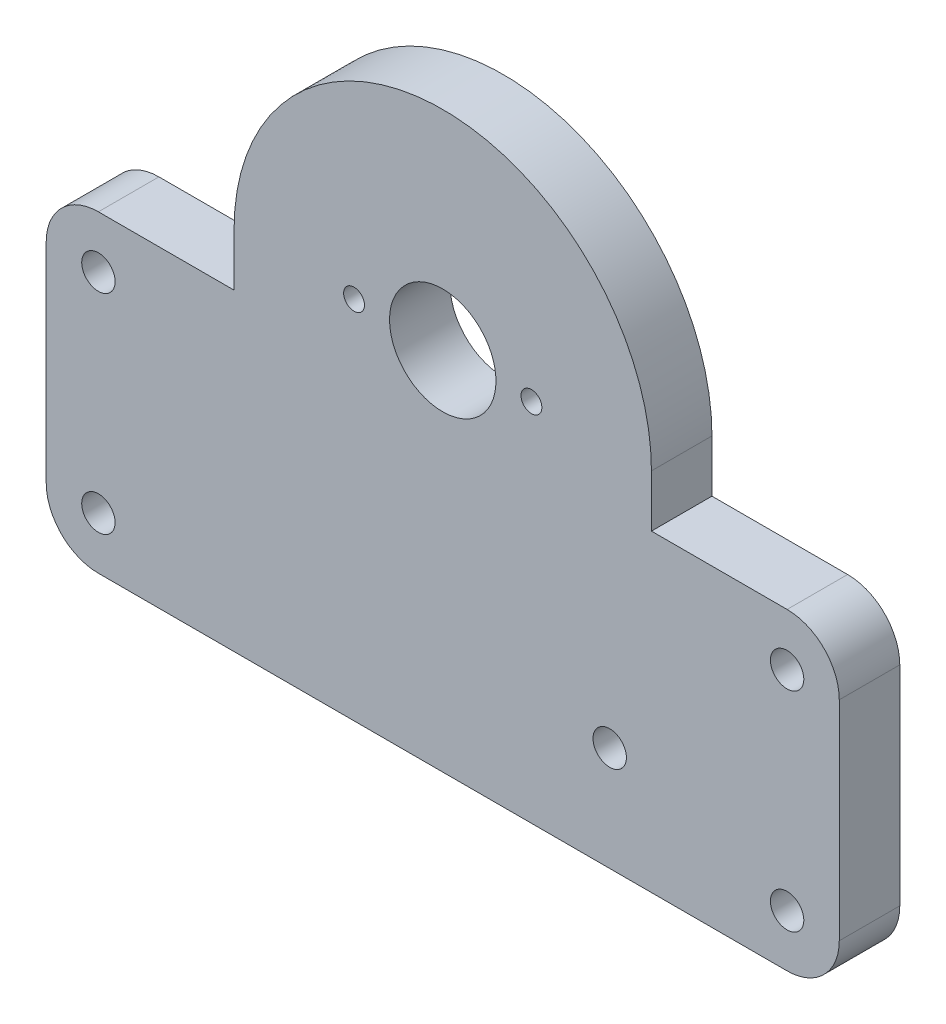
from build123d import *

# Parameters (mm, degrees)
SKETCH_1_W          = 76
SKETCH_1_H          = 60
EXTRUDE_3_DEPTH     = 5.8
SKETCH_4_R          = 5.1
SKETCH_4_R_2        = 1.6
CUT_EXTRUDE_2_DEPTH = 50
FILLET_4_R          = 5
CUT_EXTRUDE_7_DEPTH = 13.5
FILLET_8_R          = 5
SKETCH_11_R         = 1
CUT_EXTRUDE_8_DEPTH = 49.76105003
SKETCH_12_R         = 1.6
CUT_EXTRUDE_9_DEPTH = 49.76105003


with BuildPart() as part:
    # ｽｹｯﾁ1 → ﾎﾞｽ - 押し出し3 (new body)
    with BuildSketch(Plane.XY):
        Rectangle(SKETCH_1_W, SKETCH_1_H)
    extrude(amount=EXTRUDE_3_DEPTH)

    # ｽｹｯﾁ4 → ｶｯﾄ - 押し出し2 (cut)
    with BuildSketch(Plane(origin=(0, 0, 0), x_dir=(-1, 0, 0), z_dir=(0, 0, -1))):
        with Locations((0, 5)):
            Circle(SKETCH_4_R)
        with Locations((-33, -5)):
            Circle(SKETCH_4_R_2)
        with Locations((-33, -25)):
            Circle(SKETCH_4_R_2)
        with Locations((33, -25)):
            Circle(SKETCH_4_R_2)
        with Locations((33, -5)):
            Circle(SKETCH_4_R_2)
    extrude(amount=-CUT_EXTRUDE_2_DEPTH, mode=Mode.SUBTRACT)

    # ﾌｨﾚｯﾄ4
    fillet_4_edges = [part.edges().sort_by_distance(p)[0] for p in [
        (38, -30, 2.9),
        (-38, -30, 2.9),
        (-38, 30, 2.9),
        (38, 30, 2.9),
    ]]
    fillet(fillet_4_edges, radius=FILLET_4_R)

    # ｽｹｯﾁ10 → ｶｯﾄ - 押し出し7 (cut)
    with BuildSketch(Plane(origin=(0, 0, 0), x_dir=(-1, 0, 0), z_dir=(0, 0, -1))):
        with BuildLine():
            Line((-38, 0), (-20, 0))
            Line((-20, 0), (-20, 5))
            ThreePointArc((-20, 5), (0, 25), (20, 5))
            Line((20, 5), (20, 0))
            Line((20, 0), (38, 0))
            Line((38, 0), (38, 30))
            Line((38, 30), (-38, 30))
            Line((-38, 30), (-38, 0))
        make_face()
    extrude(amount=-CUT_EXTRUDE_7_DEPTH, mode=Mode.SUBTRACT)

    # ﾌｨﾚｯﾄ8
    fillet_8_edges = [part.edges().sort_by_distance(p)[0] for p in [
        (-38, 0, 2.9),
        (38, 0, 2.9),
    ]]
    fillet(fillet_8_edges, radius=FILLET_8_R)

    # ｽｹｯﾁ11 → ｶｯﾄ - 押し出し8 (cut, through all)
    with BuildSketch(Plane(origin=(0, 0, 0), x_dir=(-1, 0, 0), z_dir=(0, 0, -1))):
        with Locations((-8.5, 5)):
            Circle(SKETCH_11_R)
        with Locations(Location((8.5, 5, 0), (0, 0, 180))):
            Circle(SKETCH_11_R)
    extrude(amount=-CUT_EXTRUDE_8_DEPTH, mode=Mode.SUBTRACT)

    # ｽｹｯﾁ12 → ｶｯﾄ - 押し出し9 (cut, through all)
    with BuildSketch(Plane.XY.offset(5.8)):
        with Locations((16, -20)):
            Circle(SKETCH_12_R)
    extrude(amount=-CUT_EXTRUDE_9_DEPTH, mode=Mode.SUBTRACT)


solid = part.part
